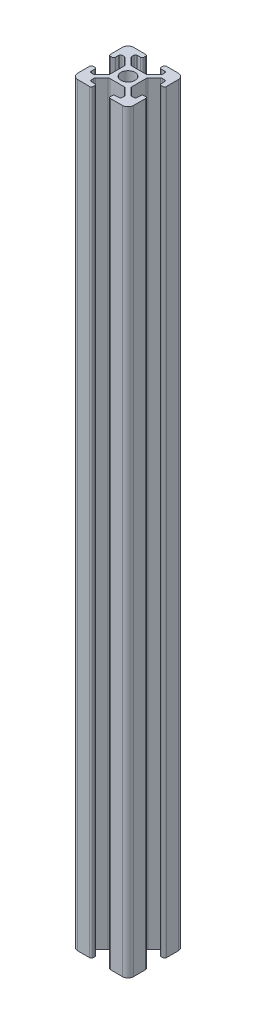
from build123d import *

# Parameters (mm, degrees)
SKETCH_1_R      = 2.5
EXTRUDE_1_DEPTH = 270


with BuildPart() as part:
    # 草图1 → 凸台-拉伸1 (new body)
    with BuildSketch(Plane(origin=(0, 0, 0), x_dir=(1, 0, 0), z_dir=(0, 1, 0))):
        with BuildLine():
            Line((3.1, 8.8), (3.1, 9.4))
            ThreePointArc((3.1, 9.4), (3.275735931, 9.824264069), (3.7, 10))
            Line((3.7, 10), (8, 10))
            ThreePointArc((8, 10), (9.414213562, 9.414213562), (10, 8))
            Line((10, 8), (10, 3.7))
            ThreePointArc((10, 3.7), (9.824264069, 3.275735931), (9.4, 3.1))
            Line((9.4, 3.1), (8.8, 3.1))
            ThreePointArc((8.8, 3.1), (8.375735931, 3.275735931), (8.2, 3.7))
            Line((8.2, 3.7), (8.2, 4.9))
            ThreePointArc((8.2, 4.9), (8.024264069, 5.324264069), (7.6, 5.5))
            Line((7.6, 5.5), (6.809188309, 5.5))
            ThreePointArc((6.809188309, 5.5), (6.57957825, 5.45432772), (6.38492424, 5.324264069))
            Line((6.38492424, 5.324264069), (4.075735931, 3.01507576))
            ThreePointArc((4.075735931, 3.01507576), (3.94567228, 2.82042175), (3.9, 2.590811691))
            Line((3.9, 2.590811691), (3.9, 0))
            Line((3.9, 0), (3.9, -2.590811691))
            ThreePointArc((3.9, -2.590811691), (3.94567228, -2.82042175), (4.075735931, -3.01507576))
            Line((4.075735931, -3.01507576), (6.38492424, -5.324264069))
            ThreePointArc((6.38492424, -5.324264069), (6.57957825, -5.45432772), (6.809188309, -5.5))
            Line((6.809188309, -5.5), (7.6, -5.5))
            ThreePointArc((7.6, -5.5), (8.024264069, -5.324264069), (8.2, -4.9))
            Line((8.2, -4.9), (8.2, -3.7))
            ThreePointArc((8.2, -3.7), (8.375735931, -3.275735931), (8.8, -3.1))
            Line((8.8, -3.1), (9.4, -3.1))
            ThreePointArc((9.4, -3.1), (9.824264069, -3.275735931), (10, -3.7))
            Line((10, -3.7), (10, -8))
            ThreePointArc((10, -8), (9.414213562, -9.414213562), (8, -10))
            Line((8, -10), (3.7, -10))
            ThreePointArc((3.7, -10), (3.275735931, -9.824264069), (3.1, -9.4))
            Line((3.1, -9.4), (3.1, -8.8))
            ThreePointArc((3.1, -8.8), (3.275735931, -8.375735931), (3.7, -8.2))
            Line((3.7, -8.2), (4.9, -8.2))
            ThreePointArc((4.9, -8.2), (5.324264069, -8.024264069), (5.5, -7.6))
            Line((5.5, -7.6), (5.5, -6.809188309))
            ThreePointArc((5.5, -6.809188309), (5.45432772, -6.57957825), (5.324264069, -6.38492424))
            Line((5.324264069, -6.38492424), (3.01507576, -4.075735931))
            ThreePointArc((3.01507576, -4.075735931), (2.82042175, -3.94567228), (2.590811691, -3.9))
            Line((2.590811691, -3.9), (0, -3.9))
            Line((0, -3.9), (-2.590811691, -3.9))
            ThreePointArc((-2.590811691, -3.9), (-2.82042175, -3.94567228), (-3.01507576, -4.075735931))
            Line((-3.01507576, -4.075735931), (-5.324264069, -6.38492424))
            ThreePointArc((-5.324264069, -6.38492424), (-5.45432772, -6.57957825), (-5.5, -6.809188309))
            Line((-5.5, -6.809188309), (-5.5, -7.6))
            ThreePointArc((-5.5, -7.6), (-5.324264069, -8.024264069), (-4.9, -8.2))
            Line((-4.9, -8.2), (-3.7, -8.2))
            ThreePointArc((-3.7, -8.2), (-3.275735931, -8.375735931), (-3.1, -8.8))
            Line((-3.1, -8.8), (-3.1, -9.4))
            ThreePointArc((-3.1, -9.4), (-3.275735931, -9.824264069), (-3.7, -10))
            Line((-3.7, -10), (-8, -10))
            ThreePointArc((-8, -10), (-9.414213562, -9.414213562), (-10, -8))
            Line((-10, -8), (-10, -3.7))
            ThreePointArc((-10, -3.7), (-9.824264069, -3.275735931), (-9.4, -3.1))
            Line((-9.4, -3.1), (-8.8, -3.1))
            ThreePointArc((-8.8, -3.1), (-8.375735931, -3.275735931), (-8.2, -3.7))
            Line((-8.2, -3.7), (-8.2, -4.9))
            ThreePointArc((-8.2, -4.9), (-8.024264069, -5.324264069), (-7.6, -5.5))
            Line((-7.6, -5.5), (-6.809188309, -5.5))
            ThreePointArc((-6.809188309, -5.5), (-6.57957825, -5.45432772), (-6.38492424, -5.324264069))
            Line((-6.38492424, -5.324264069), (-4.075735931, -3.01507576))
            ThreePointArc((-4.075735931, -3.01507576), (-3.94567228, -2.82042175), (-3.9, -2.590811691))
            Line((-3.9, -2.590811691), (-3.9, 0))
            Line((-3.9, 0), (-3.9, 2.590811691))
            ThreePointArc((-3.9, 2.590811691), (-3.94567228, 2.82042175), (-4.075735931, 3.01507576))
            Line((-4.075735931, 3.01507576), (-6.38492424, 5.324264069))
            ThreePointArc((-6.38492424, 5.324264069), (-6.57957825, 5.45432772), (-6.809188309, 5.5))
            Line((-6.809188309, 5.5), (-7.6, 5.5))
            ThreePointArc((-7.6, 5.5), (-8.024264069, 5.324264069), (-8.2, 4.9))
            Line((-8.2, 4.9), (-8.2, 3.7))
            ThreePointArc((-8.2, 3.7), (-8.375735931, 3.275735931), (-8.8, 3.1))
            Line((-8.8, 3.1), (-9.4, 3.1))
            ThreePointArc((-9.4, 3.1), (-9.824264069, 3.275735931), (-10, 3.7))
            Line((-10, 3.7), (-10, 8))
            ThreePointArc((-10, 8), (-9.414213562, 9.414213562), (-8, 10))
            Line((-8, 10), (-3.7, 10))
            ThreePointArc((-3.7, 10), (-3.275735931, 9.824264069), (-3.1, 9.4))
            Line((-3.1, 9.4), (-3.1, 8.8))
            ThreePointArc((-3.1, 8.8), (-3.275735931, 8.375735931), (-3.7, 8.2))
            Line((-3.7, 8.2), (-4.9, 8.2))
            ThreePointArc((-4.9, 8.2), (-5.324264069, 8.024264069), (-5.5, 7.6))
            Line((-5.5, 7.6), (-5.5, 6.809188309))
            ThreePointArc((-5.5, 6.809188309), (-5.45432772, 6.57957825), (-5.324264069, 6.38492424))
            Line((-5.324264069, 6.38492424), (-3.01507576, 4.075735931))
            ThreePointArc((-3.01507576, 4.075735931), (-2.82042175, 3.94567228), (-2.590811691, 3.9))
            Line((-2.590811691, 3.9), (0, 3.9))
            Line((0, 3.9), (2.590811691, 3.9))
            ThreePointArc((2.590811691, 3.9), (2.82042175, 3.94567228), (3.01507576, 4.075735931))
            Line((3.01507576, 4.075735931), (5.324264069, 6.38492424))
            ThreePointArc((5.324264069, 6.38492424), (5.45432772, 6.57957825), (5.5, 6.809188309))
            Line((5.5, 6.809188309), (5.5, 7.6))
            ThreePointArc((5.5, 7.6), (5.324264069, 8.024264069), (4.9, 8.2))
            Line((4.9, 8.2), (3.7, 8.2))
            ThreePointArc((3.7, 8.2), (3.275735931, 8.375735931), (3.1, 8.8))
        make_face()
        with Locations(Location((0, 0, 0), (0, 0, 270))):
            Circle(SKETCH_1_R, mode=Mode.SUBTRACT)
    extrude(amount=EXTRUDE_1_DEPTH)


solid = part.part
